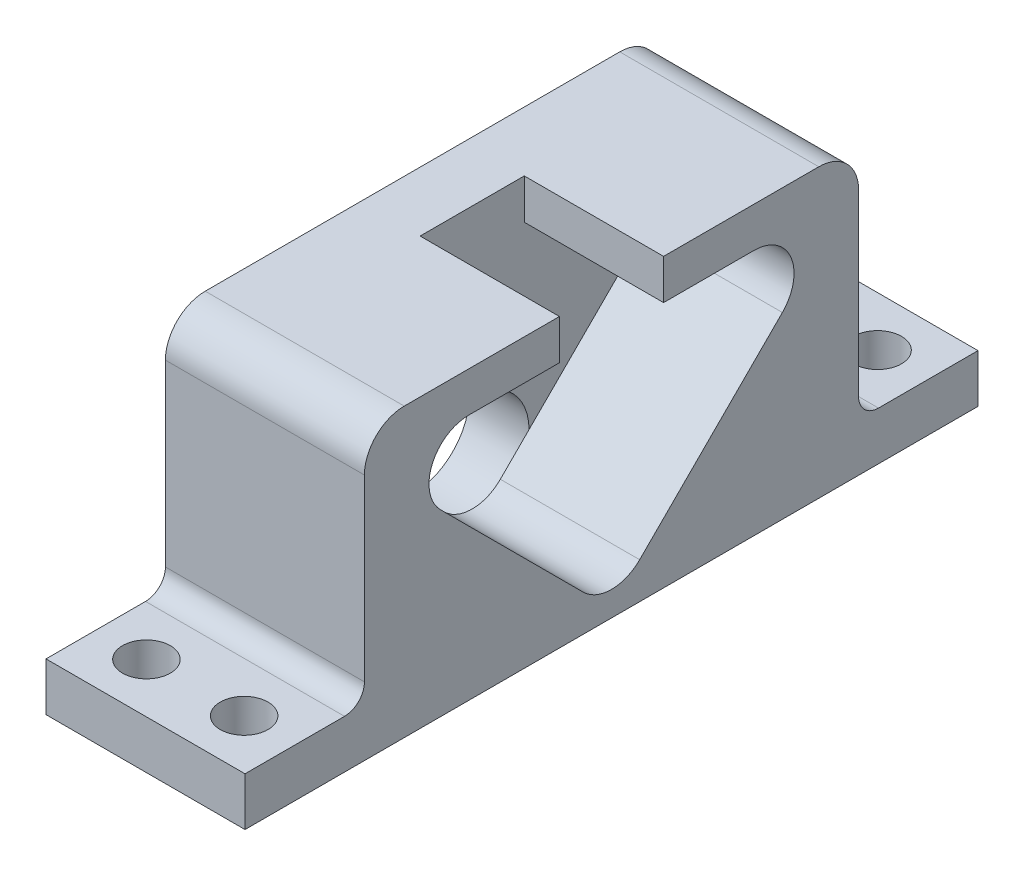
from build123d import *

# Parameters (mm, degrees)
BOSS_EXTRUDE2_DEPTH = 25
CUT_EXTRUDE2_DEPTH  = 35
FILLET3_R           = 10
SKETCH5_R           = 14.294796693
CUT_EXTRUDE3_DEPTH  = 15
FILLET4_R           = 10
FILLET5_R           = 5
SKETCH6_R           = 6
CUT_EXTRUDE4_DEPTH  = 35
SKETCH8_W           = 35
SKETCH8_H           = 26.166184444
CUT_EXTRUDE6_DEPTH  = 10.066320609
SCALE1_SCALE        = 0.25


with BuildPart() as part:
    # Sketch2 → Boss-Extrude2 (new, symmetric)
    with BuildSketch(Plane(origin=(0, 0, 0), x_dir=(0, 0, -1), z_dir=(1, 0, 0))):
        Polygon((-62.071067812, 55), (-62.071067812, -5), (-92.071067812, -5), (-92.071067812, -17.136235823), (92.071067812, -17.136235823), (92.071067812, -5), (62.071067812, -5), (62.071067812, 55), align=None)
    extrude(amount=BOSS_EXTRUDE2_DEPTH, both=True)

    # Sketch3 → Cut-Extrude2 (cut)
    with BuildSketch(Plane(origin=(25, 0, 0), x_dir=(0, 0, -1), z_dir=(1, 0, 0))):
        Polygon((0, -15.066320609), (60, 44.933679391), (-60, 44.933679391), align=None)
    extrude(amount=-CUT_EXTRUDE2_DEPTH, mode=Mode.SUBTRACT)

    # Fillet3
    fillet3_edges = [part.edges().sort_by_distance(p)[0] for p in [
        (7.5, -15.066320609, 0),
        (7.5, 44.933679391, 60),
        (7.5, 44.933679391, -60),
    ]]
    fillet(fillet3_edges, radius=FILLET3_R)

    # Sketch5 → Cut-Extrude3 (cut)
    with BuildSketch(Plane(origin=(-10, 0, 0), x_dir=(0, 0, -1), z_dir=(1, 0, 0))):
        with Locations((0, -0.924184985)):
            Circle(SKETCH5_R)
    extrude(amount=-CUT_EXTRUDE3_DEPTH, mode=Mode.SUBTRACT)

    # Fillet4
    fillet4_edges = [part.edges().sort_by_distance(p)[0] for p in [
        (0, 55, 62.071067812),
        (0, 55, -62.071067812),
    ]]
    fillet(fillet4_edges, radius=FILLET4_R)

    # Fillet5
    fillet5_edges = [part.edges().sort_by_distance(p)[0] for p in [
        (0, -5, -62.071067812),
        (0, -5, 62.071067812),
    ]]
    fillet(fillet5_edges, radius=FILLET5_R)

    # Sketch6 → Cut-Extrude4 (cut)
    with BuildSketch(Plane(origin=(0, -5, 0), x_dir=(1, 0, 0), z_dir=(0, 1, 0))):
        with Locations(Location((-12.273124469, -79.571067812, 0), (0, 0, 270))):
            Circle(SKETCH6_R)
        with Locations(Location((12.273124469, -79.571067812, 0), (0, 0, 270))):
            Circle(SKETCH6_R)
    cut_extrude4 = extrude(amount=-CUT_EXTRUDE4_DEPTH, mode=Mode.SUBTRACT)

    # Mirror1: Cut-Extrude4 across plane
    add(cut_extrude4.mirror(Plane.XY), mode=Mode.SUBTRACT)

    # Sketch8 → Cut-Extrude6 (cut)
    with BuildSketch(Plane(origin=(0, 55, 0), x_dir=(1, 0, 0), z_dir=(0, 1, 0))):
        with Locations((7.5, 0)):
            Rectangle(SKETCH8_W, SKETCH8_H)
    extrude(amount=-CUT_EXTRUDE6_DEPTH, mode=Mode.SUBTRACT)


with BuildPart() as part_1:
    # Scale1: scaled about (-2.268878972, 13.955162183, 0)
    add(part.part.scale(SCALE1_SCALE).moved(Location((-1.701659229, 10.466371637, 0))))


solid = part_1.part
